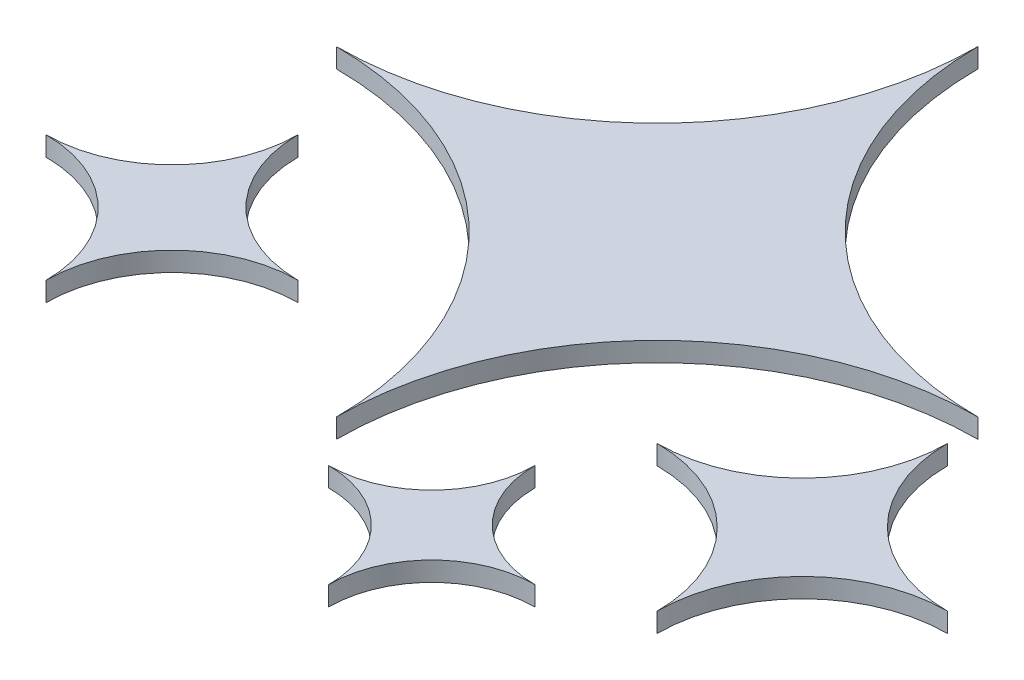
from build123d import *

# Parameters (mm, degrees)
BOSS_EXTRUDE1_DEPTH   = 2.54
BOSS_EXTRUDE1_2_DEPTH = 2.54
BOSS_EXTRUDE1_3_DEPTH = 2.54
BOSS_EXTRUDE1_4_DEPTH = 2.54


with BuildPart() as part:
    # Sketch1 → Boss-Extrude1 (new body)
    with BuildSketch(Plane(origin=(0, 0, 0), x_dir=(1, 0, 0), z_dir=(0, 1, 0))):
        with BuildLine():
            ThreePointArc((67.000008539, 113.499997607), (54.698492361, 83.801510412), (25.000005167, 71.499994235))
            ThreePointArc((25.000005167, 71.499994235), (54.698492361, 59.198478057), (67.000008539, 29.499990863))
            ThreePointArc((67.000008539, 29.499990863), (79.301524717, 59.198478057), (109.000011911, 71.499994235))
            ThreePointArc((109.000011911, 71.499994235), (79.301524717, 83.801510412), (67.000008539, 113.499997607))
        make_face()
    extrude(amount=BOSS_EXTRUDE1_DEPTH)


with BuildPart() as body_2:
    # Sketch1 → Boss-Extrude1 2 (new body)
    with BuildSketch(Plane(origin=(0, 0, 0), x_dir=(1, 0, 0), z_dir=(0, 1, 0))):
        with BuildLine():
            ThreePointArc((110.000007153, 66.500014723), (104.435033198, 53.064979127), (90.999997602, 47.500005172))
            ThreePointArc((90.999997602, 47.500005172), (104.435033198, 41.935031217), (110.000007153, 28.49999562))
            ThreePointArc((110.000007153, 28.49999562), (115.564981108, 41.935031217), (129.000016704, 47.500005172))
            ThreePointArc((129.000016704, 47.500005172), (115.564981108, 53.064979127), (110.000007153, 66.500014723))
        make_face()
    extrude(amount=BOSS_EXTRUDE1_2_DEPTH)


with BuildPart() as body_3:
    # Sketch1 → Boss-Extrude1 3 (new body)
    with BuildSketch(Plane(origin=(0, 0, 0), x_dir=(1, 0, 0), z_dir=(0, 1, 0))):
        with BuildLine():
            ThreePointArc((85.50000216, 37.000007637), (81.545941793, 27.454061472), (71.999995628, 23.500001105))
            ThreePointArc((71.999995628, 23.500001105), (81.545941793, 19.545940737), (85.50000216, 9.999994572))
            ThreePointArc((85.50000216, 9.999994572), (89.454062528, 19.545940737), (99.000008693, 23.500001105))
            ThreePointArc((99.000008693, 23.500001105), (89.454062528, 27.454061472), (85.50000216, 37.000007637))
        make_face()
    extrude(amount=BOSS_EXTRUDE1_3_DEPTH)


with BuildPart() as body_4:
    # Sketch1 → Boss-Extrude1 4 (new body)
    with BuildSketch(Plane(origin=(0, 0, 0), x_dir=(1, 0, 0), z_dir=(0, 1, 0))):
        with BuildLine():
            ThreePointArc((32.500005891, 59.000000429), (27.66726702, 47.332736703), (16.000003294, 42.499997832))
            ThreePointArc((16.000003294, 42.499997832), (27.66726702, 37.667258961), (32.500005891, 25.999995235))
            ThreePointArc((32.500005891, 25.999995235), (37.332744762, 37.667258961), (49.000008488, 42.499997832))
            ThreePointArc((49.000008488, 42.499997832), (37.332744762, 47.332736703), (32.500005891, 59.000000429))
        make_face()
    extrude(amount=BOSS_EXTRUDE1_4_DEPTH)


solid = Compound([part.part, body_2.part, body_3.part, body_4.part])
